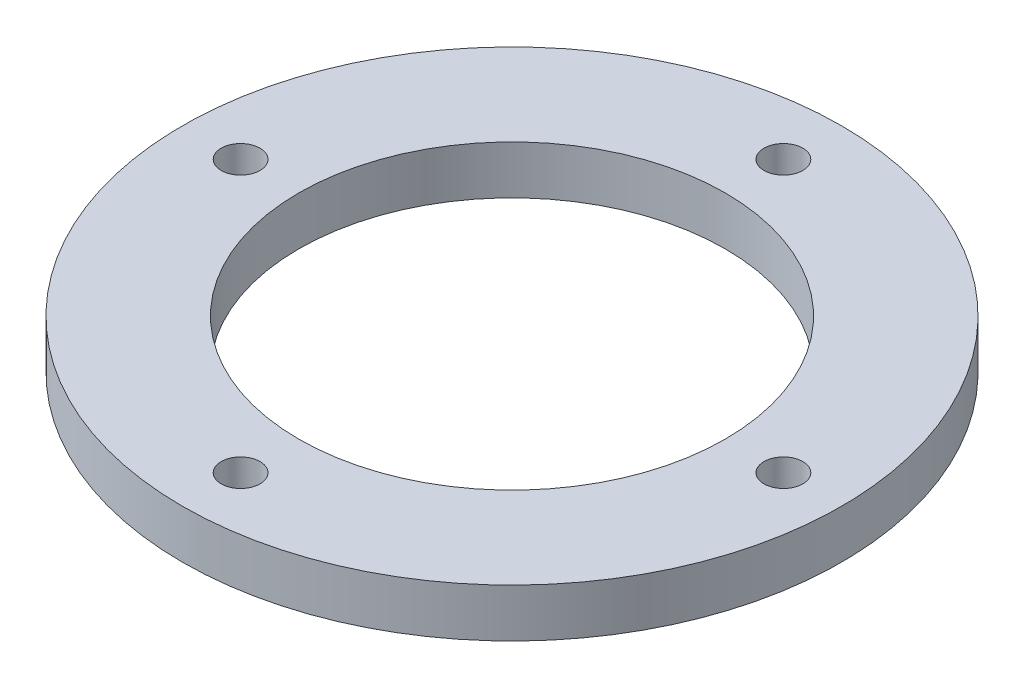
from build123d import *

# Parameters (mm, degrees)
SKETCH_1_R               = 34
EXTRUDE_1_DEPTH          = 5
SKETCH_2_R               = 22
CUT_EXTRUDE_1_DEPTH      = 5
SKETCH_3_R               = 2
CUT_EXTRUDE_2_DEPTH      = 5
PATTERN_CIRCULAR_1_COUNT = 4


with BuildPart() as part:
    # 草图1 → 凸台-拉伸1 (new body)
    with BuildSketch(Plane(origin=(0, 0, 0), x_dir=(1, 0, 0), z_dir=(0, 1, 0))):
        with Locations(Location((0, 0, 0), (0, 0, 270))):
            Circle(SKETCH_1_R)
    extrude(amount=EXTRUDE_1_DEPTH)

    # 草图2 → 切除-拉伸1 (cut)
    with BuildSketch(Plane(origin=(0, 5, 0), x_dir=(1, 0, 0), z_dir=(0, 1, 0))):
        with Locations(Location((0, 0, 0), (0, 0, 270))):
            Circle(SKETCH_2_R)
    extrude(amount=-CUT_EXTRUDE_1_DEPTH, mode=Mode.SUBTRACT)

    # 草图3 → 切除-拉伸2 (cut)
    with BuildSketch(Plane(origin=(0, 5, 0), x_dir=(1, 0, 0), z_dir=(0, 1, 0))):
        with Locations(Location((0, 28, 0), (0, 0, 270))):
            Circle(SKETCH_3_R)
    cut_extrude_2 = extrude(amount=-CUT_EXTRUDE_2_DEPTH, mode=Mode.SUBTRACT)

    # 阵列(圆周)1: 切除-拉伸2 ×4 about axis
    pattern_circular_1_axis = Axis((0, 0, 0), (0, 1, 0))
    for i in range(1, PATTERN_CIRCULAR_1_COUNT):
        add(cut_extrude_2.rotate(pattern_circular_1_axis, i * 360 / PATTERN_CIRCULAR_1_COUNT), mode=Mode.SUBTRACT)


solid = part.part
